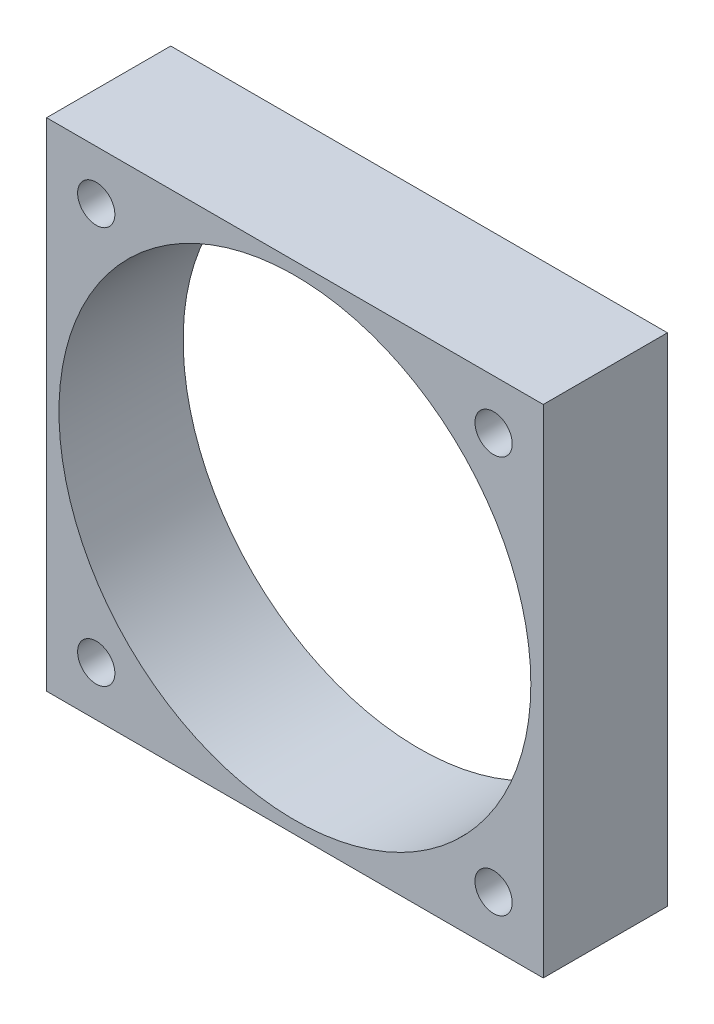
from build123d import *

# Parameters (mm, degrees)
SKETCH_1_W          = 40
SKETCH_1_H          = 40
EXTRUDE_1_DEPTH     = 10
SKETCH_2_R          = 19
CUT_EXTRUDE_1_DEPTH = 31
SKETCH_3_R          = 1.5
CUT_EXTRUDE_2_DEPTH = 31


with BuildPart() as part:
    # 草圖1 → 填料-伸長1 (new body)
    with BuildSketch(Plane.XY):
        Rectangle(SKETCH_1_W, SKETCH_1_H)
    extrude(amount=EXTRUDE_1_DEPTH)

    # 草圖2 → 除料-伸長1 (cut, through all)
    with BuildSketch(Plane.XY.offset(10)):
        Circle(SKETCH_2_R)
    extrude(amount=-CUT_EXTRUDE_1_DEPTH, mode=Mode.SUBTRACT)

    # 草圖3 → 除料-伸長2 (cut, through all)
    with BuildSketch(Plane.XY.offset(10)):
        with Locations((-16, 16)):
            Circle(SKETCH_3_R)
        with Locations((-16, -16)):
            Circle(SKETCH_3_R)
        with Locations((16, -16)):
            Circle(SKETCH_3_R)
        with Locations((16, 16)):
            Circle(SKETCH_3_R)
    extrude(amount=-CUT_EXTRUDE_2_DEPTH, mode=Mode.SUBTRACT)


solid = part.part
